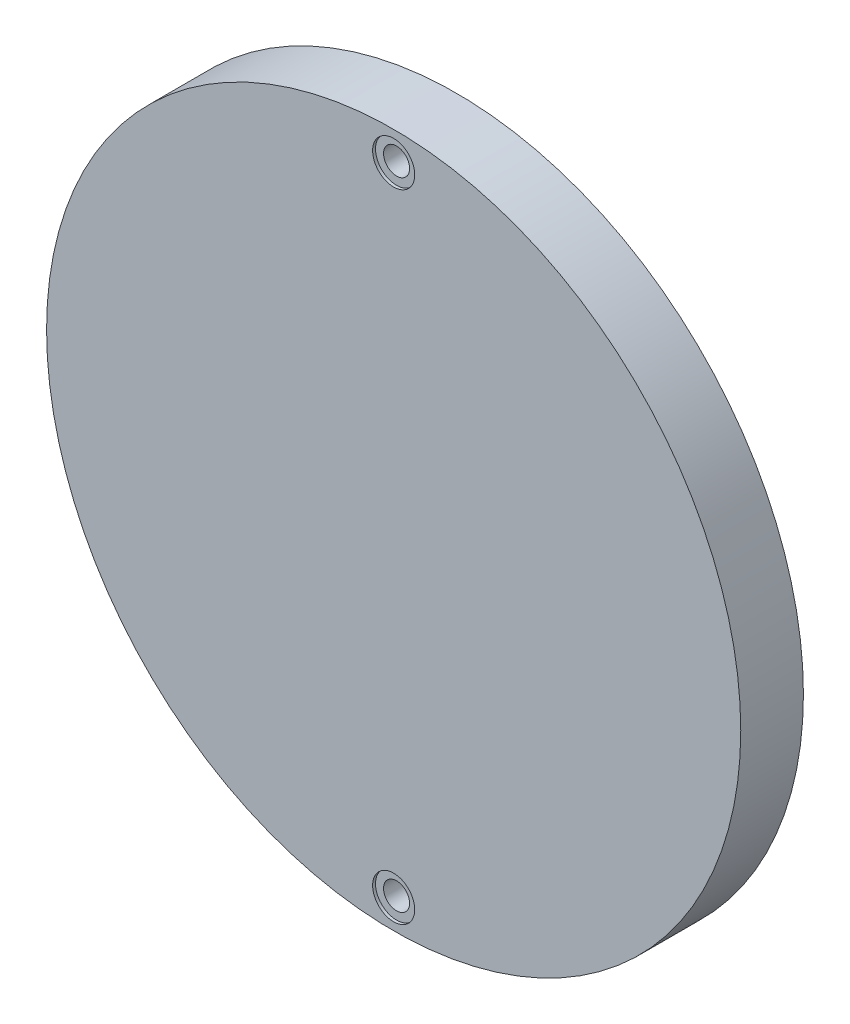
from build123d import *

# Parameters (mm, degrees)
SKETCH1_R           = 36
BOSS_EXTRUDE1_DEPTH = 6.5
SKETCH11_R          = 2.1844
CUT_EXTRUDE3_DEPTH  = 0.3


with BuildPart() as part:
    # Sketch1 → Boss-Extrude1 (new body)
    with BuildSketch(Plane.XY):
        with Locations(Location((0, 0, 0), (0, 0, 180))):
            Circle(SKETCH1_R)
    extrude(amount=BOSS_EXTRUDE1_DEPTH)

    # Sketch10 → #4-40 Tapped Hole1 (revolve, cut)
    with BuildSketch(Plane(origin=(0, -33, 0), x_dir=(0, 1, 0), z_dir=(1, 0, 0))):
        Polygon((0, 0), (0, 7.311161816), (1.349999967, 6.5), (1.349999967, 1.132779999), (2.6999946, 0), align=None)
    f_4_40_tapped_hole1 = revolve(axis=Axis((0, -33, -6.35), (0, 0, 1)), mode=Mode.SUBTRACT)

    # Sketch11 → Cut-Extrude3 (cut)
    with BuildSketch(Plane.XY.offset(6.5)):
        with Locations((0, -33)):
            Circle(SKETCH11_R)
    cut_extrude3 = extrude(amount=-CUT_EXTRUDE3_DEPTH, mode=Mode.SUBTRACT)

    # Mirror1: #4-40 Tapped Hole1, Cut-Extrude3 across plane
    add(f_4_40_tapped_hole1.mirror(Plane(origin=(0, 0, 0), x_dir=(0, 0, 1), z_dir=(0, -1, 0))), mode=Mode.SUBTRACT)
    add(cut_extrude3.mirror(Plane(origin=(0, 0, 0), x_dir=(0, 0, 1), z_dir=(0, -1, 0))), mode=Mode.SUBTRACT)


solid = part.part
